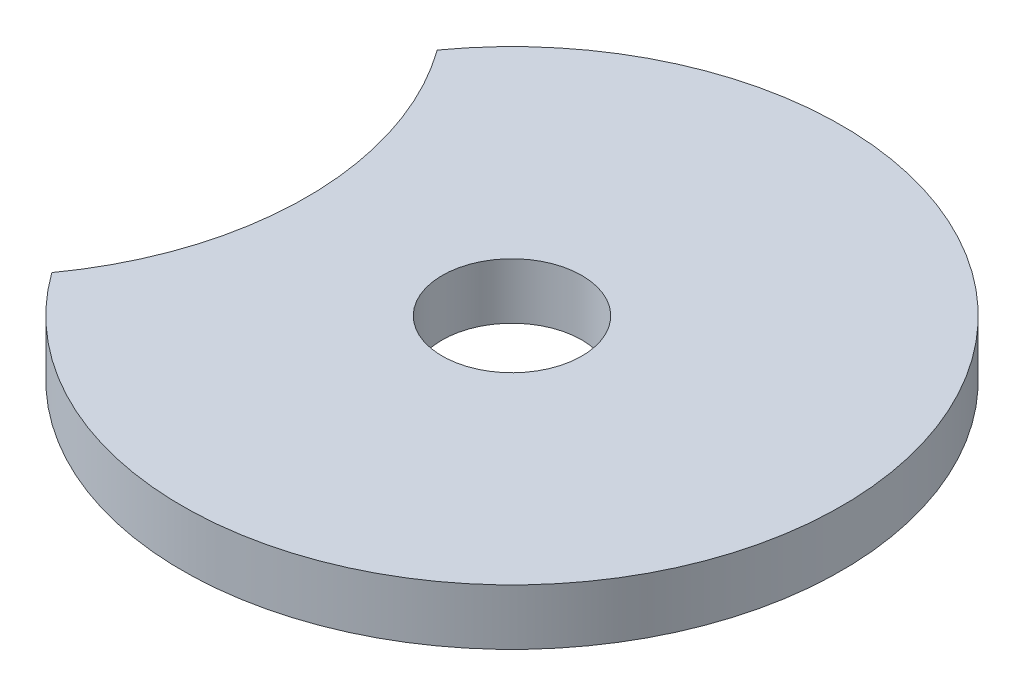
from build123d import *

# Parameters (mm, degrees)
SKETCH1_R           = 9.525
BOSS_EXTRUDE1_DEPTH = 7.62


with BuildPart() as part:
    # Sketch1 → Boss-Extrude1 (new body)
    with BuildSketch(Plane(origin=(0, 0, 0), x_dir=(1, 0, 0), z_dir=(0, 1, 0))):
        with BuildLine():
            ThreePointArc((-36.477847672, -26.27904856), (44.958, 0), (-36.477847672, 26.27904856))
            ThreePointArc((-36.477847672, 26.27904856), (-27.997695344, 0), (-36.477847672, -26.27904856))
        make_face()
        with Locations(Location((0, 0, 0), (0, 0, 90))):
            Circle(SKETCH1_R, mode=Mode.SUBTRACT)
    extrude(amount=BOSS_EXTRUDE1_DEPTH)


solid = part.part
